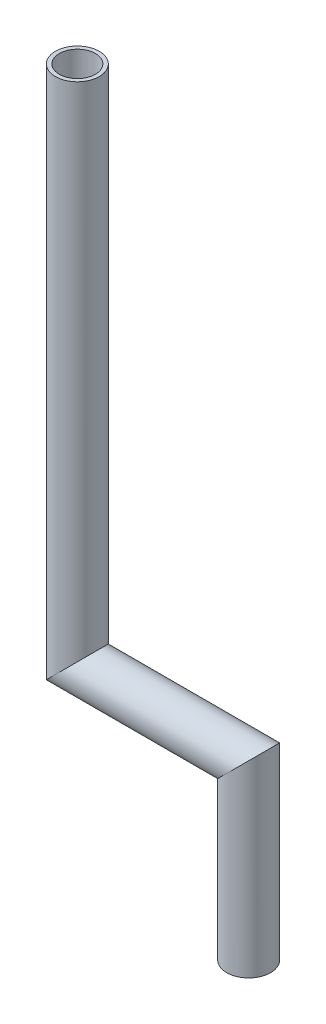
from build123d import *

# Parameters (mm, degrees)
SKETCH2_R   = 12.7
SKETCH2_R_2 = 10.458255758


with BuildPart() as part:
    # Sweep1: sweep along a path in Sketch1
    with BuildLine(Plane.XY) as sweep1_path:
        Line((0, 300), (0, 0))
        Line((0, 0), (99.24397827, 0))
        Line((99.24397827, 0), (99.24397827, -100))
    # Sketch2 → Sweep1 (sweep)
    with BuildSketch(Plane(origin=(0, 300, 0), x_dir=(1, 0, 0), z_dir=(0, 1, 0))):
        Circle(SKETCH2_R)
        Circle(SKETCH2_R_2, mode=Mode.SUBTRACT)
    sweep(path=sweep1_path.line, transition=Transition.RIGHT)


solid = part.part
